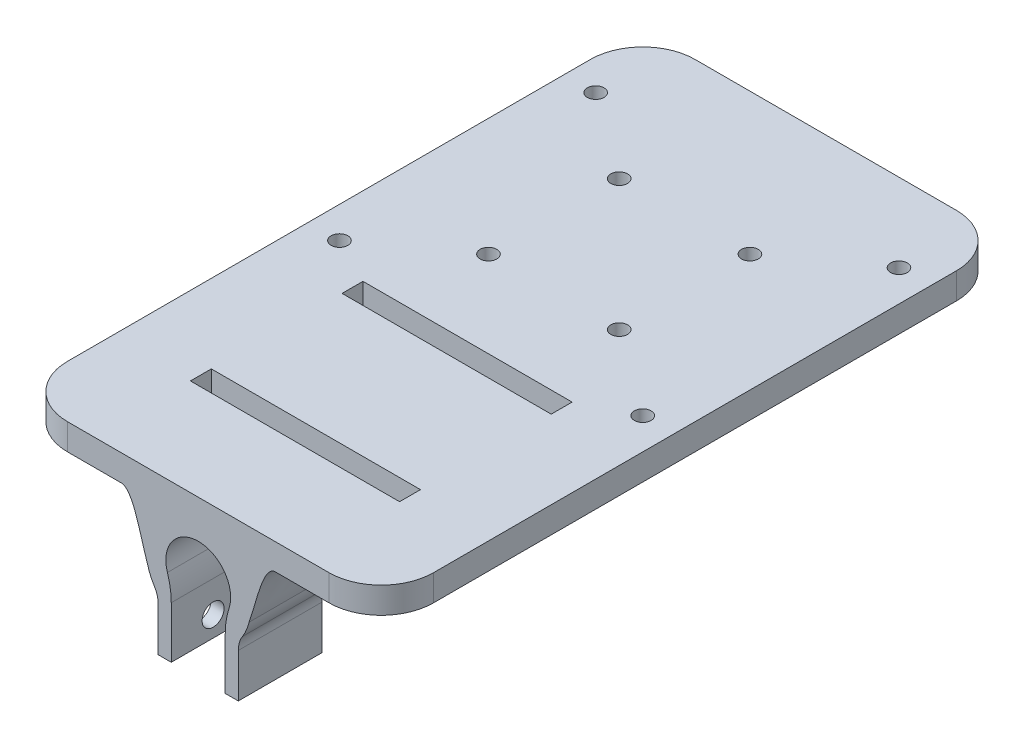
from build123d import *

# Parameters (mm, degrees)
BOSS_EXTRUDE2_START = 10
SKETCH3_W           = 70
SKETCH3_H           = 5
BOSS_EXTRUDE2_DEPTH = 120
BOSS_EXTRUDE3_START = 18
BOSS_EXTRUDE3_DEPTH = 8
SKETCH4_R           = 2.1
CUT_EXTRUDE1_DEPTH  = 11
FILLET1_R           = 10
SKETCH5_R           = 1.6
CUT_EXTRUDE2_DEPTH  = 11
CUT_EXTRUDE5_REACH  = 139.915
SKETCH7_R           = 1.6
CUT_EXTRUDE6_REACH  = 139.915
SKETCH6_W           = 40
SKETCH6_H           = 4


with BuildPart() as part:
    # Sketch3 → Boss-Extrude2 (new body)
    with BuildSketch(Plane.XY.offset(BOSS_EXTRUDE2_START)):
        with Locations((0, 11)):
            Rectangle(SKETCH3_W, SKETCH3_H)
    extrude(amount=BOSS_EXTRUDE2_DEPTH)

    # Sketch1 → Boss-Extrude3 (add, symmetric)
    with BuildSketch(Plane.XY.offset(BOSS_EXTRUDE3_START)):
        with BuildLine():
            Line((-14.625621312, 8.5), (14.625621312, 8.5))
            add(Edge.make_bspline(
                [(14.625621312, 8.5), (12.253002272, 8.152861079), (11.086674652, 1.382068579), (9.719671925, -2.351165174)],
                knots=[0, 0, 0, 0, 1, 1, 1, 1], degree=3))
            ThreePointArc((9.719671925, -2.351165174), (9.204012528, -3.909751064), (8.440296287, -5.362965465))
            ThreePointArc((8.440296287, -5.362965465), (7.859364307, -6.648156809), (7.660444431, -8.044448198))
            Line((7.660444431, -8.044448198), (7.660444431, -16.427876097))
            Line((7.660444431, -16.427876097), (6.160444431, -16.427876097))
            Line((6.160444431, -16.427876097), (5.160444431, -16.427876097))
            Line((5.160444431, -16.427876097), (5.160444431, -6.557170147))
            ThreePointArc((5.160444431, -6.557170147), (5.34546922, -4.208445066), (5.895979032, -1.917662968))
            ThreePointArc((5.895979032, -1.917662968), (0, 6.2), (-5.895979032, -1.917662968))
            ThreePointArc((-5.895979032, -1.917662968), (-5.34546922, -4.208445066), (-5.160444431, -6.557170147))
            Line((-5.160444431, -6.557170147), (-5.160444431, -16.427876097))
            Line((-5.160444431, -16.427876097), (-6.160444431, -16.427876097))
            Line((-6.160444431, -16.427876097), (-7.660444431, -16.427876097))
            Line((-7.660444431, -16.427876097), (-7.660444431, -8.044448198))
            ThreePointArc((-7.660444431, -8.044448198), (-7.859364307, -6.648156809), (-8.440296287, -5.362965465))
            ThreePointArc((-8.440296287, -5.362965465), (-9.204012528, -3.909751064), (-9.719671925, -2.351165174))
            add(Edge.make_bspline(
                [(-14.625621312, 8.5), (-12.253002272, 8.152861079), (-11.086674652, 1.382068579), (-9.719671925, -2.351165174)],
                knots=[0, 0, 0, 0, 1, 1, 1, 1], degree=3))
        make_face()
    boss_extrude3 = extrude(amount=BOSS_EXTRUDE3_DEPTH, both=True)

    # Sketch4 → Cut-Extrude1 (cut)
    with BuildSketch(Plane.ZY.offset(7.660444431)):
        with Locations(Location((18, -12.521824291, 0), (0, 0, 270))):
            Circle(SKETCH4_R)
    cut_extrude1 = extrude(amount=-CUT_EXTRUDE1_DEPTH, mode=Mode.SUBTRACT)

    # Mirror2: Boss-Extrude3, Cut-Extrude1 across plane
    add(boss_extrude3.mirror(Plane.XY.offset(70)))
    add(cut_extrude1.mirror(Plane.XY.offset(70)), mode=Mode.SUBTRACT)

    # Fillet1
    fillet1_edges = [part.edges().sort_by_distance(p)[0] for p in [
        (-35, 11, 130),
        (35, 11, 130),
        (-35, 11, 10),
        (35, 11, 10),
    ]]
    fillet(fillet1_edges, radius=FILLET1_R)

    # Sketch5 → Cut-Extrude2 (cut)
    with BuildSketch(Plane(origin=(0, 13.5, 0), x_dir=(1, 0, 0), z_dir=(0, 1, 0))):
        with Locations(Location((29, -25, 0), (0, 0, 270))):
            Circle(SKETCH5_R)
        with Locations(Location((29, -74, 0), (0, 0, 270))):
            Circle(SKETCH5_R)
        with Locations(Location((-29, -74, 0), (0, 0, 270))):
            Circle(SKETCH5_R)
        with Locations(Location((-29, -25, 0), (0, 0, 270))):
            Circle(SKETCH5_R)
    extrude(amount=-CUT_EXTRUDE2_DEPTH, mode=Mode.SUBTRACT)

    # Sketch7 → Cut-Extrude5 (cut, up to next)
    with BuildSketch(Plane(origin=(0, 13.5, 0), x_dir=(1, 0, 0), z_dir=(0, 1, 0)), mode=Mode.PRIVATE) as cut_extrude5_sk1:
        with Locations(Location((12.5, -37, 0), (0, 0, 270))):
            Circle(SKETCH7_R)
    cut_extrude5_tool1 = extrude(cut_extrude5_sk1.sketch, amount=-CUT_EXTRUDE5_REACH, mode=Mode.PRIVATE) & part.part
    # Sketch7 → Cut-Extrude5 (cut, up to next)
    with BuildSketch(Plane(origin=(0, 13.5, 0), x_dir=(1, 0, 0), z_dir=(0, 1, 0)), mode=Mode.PRIVATE) as cut_extrude5_sk2:
        with Locations(Location((12.5, -62, 0), (0, 0, 270))):
            Circle(SKETCH7_R)
    cut_extrude5_tool2 = extrude(cut_extrude5_sk2.sketch, amount=-CUT_EXTRUDE5_REACH, mode=Mode.PRIVATE) & part.part
    # Sketch7 → Cut-Extrude5 (cut, up to next)
    with BuildSketch(Plane(origin=(0, 13.5, 0), x_dir=(1, 0, 0), z_dir=(0, 1, 0)), mode=Mode.PRIVATE) as cut_extrude5_sk3:
        with Locations(Location((-12.5, -62, 0), (0, 0, 270))):
            Circle(SKETCH7_R)
    cut_extrude5_tool3 = extrude(cut_extrude5_sk3.sketch, amount=-CUT_EXTRUDE5_REACH, mode=Mode.PRIVATE) & part.part
    # Sketch7 → Cut-Extrude5 (cut, up to next)
    with BuildSketch(Plane(origin=(0, 13.5, 0), x_dir=(1, 0, 0), z_dir=(0, 1, 0)), mode=Mode.PRIVATE) as cut_extrude5_sk4:
        with Locations(Location((-12.5, -37, 0), (0, 0, 270))):
            Circle(SKETCH7_R)
    cut_extrude5_tool4 = extrude(cut_extrude5_sk4.sketch, amount=-CUT_EXTRUDE5_REACH, mode=Mode.PRIVATE) & part.part
    add(cut_extrude5_tool1.solids().sort_by_distance((12.5, 13.5, 37))[0], mode=Mode.SUBTRACT)
    add(cut_extrude5_tool2.solids().sort_by_distance((12.5, 13.5, 62))[0], mode=Mode.SUBTRACT)
    add(cut_extrude5_tool3.solids().sort_by_distance((-12.5, 13.5, 62))[0], mode=Mode.SUBTRACT)
    add(cut_extrude5_tool4.solids().sort_by_distance((-12.5, 13.5, 37))[0], mode=Mode.SUBTRACT)

    # Sketch6 → Cut-Extrude6 (cut, up to next)
    with BuildSketch(Plane(origin=(0, 13.5, 0), x_dir=(1, 0, 0), z_dir=(0, 1, 0)), mode=Mode.PRIVATE) as cut_extrude6_sk1:
        with Locations((0, -80.5)):
            Rectangle(SKETCH6_W, SKETCH6_H)
    cut_extrude6_tool1 = extrude(cut_extrude6_sk1.sketch, amount=-CUT_EXTRUDE6_REACH, mode=Mode.PRIVATE) & part.part
    # Sketch6 → Cut-Extrude6 (cut, up to next)
    with BuildSketch(Plane(origin=(0, 13.5, 0), x_dir=(1, 0, 0), z_dir=(0, 1, 0)), mode=Mode.PRIVATE) as cut_extrude6_sk2:
        with Locations((0, -109.5)):
            Rectangle(SKETCH6_W, SKETCH6_H)
    cut_extrude6_tool2 = extrude(cut_extrude6_sk2.sketch, amount=-CUT_EXTRUDE6_REACH, mode=Mode.PRIVATE) & part.part
    add(cut_extrude6_tool1.solids().sort_by_distance((0, 13.5, 80.5))[0], mode=Mode.SUBTRACT)
    add(cut_extrude6_tool2.solids().sort_by_distance((0, 13.5, 109.5))[0], mode=Mode.SUBTRACT)


solid = part.part
